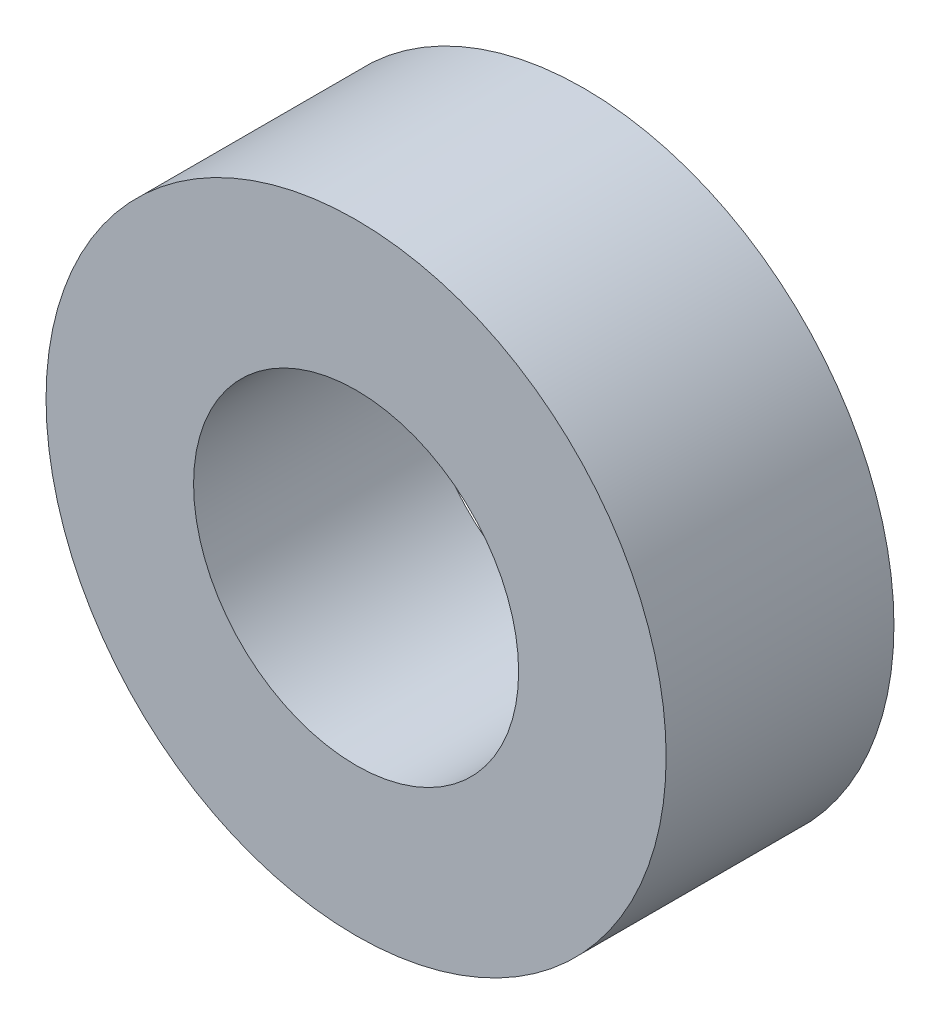
from build123d import *

# Parameters (mm, degrees)
SKETCH1_R           = 15.142307663
BOSS_EXTRUDE1_DEPTH = 11.1252
SKETCH2_R           = 7.9375
CUT_EXTRUDE1_DEPTH  = 11.1252


with BuildPart() as part:
    # Sketch1 → Boss-Extrude1 (new body)
    with BuildSketch(Plane.XY):
        with Locations(Location((0, 0, 0), (0, 0, 180))):
            Circle(SKETCH1_R)
    extrude(amount=BOSS_EXTRUDE1_DEPTH)

    # Sketch2 → Cut-Extrude1 (cut)
    with BuildSketch(Plane(origin=(0, 0, 0), x_dir=(-1, 0, 0), z_dir=(0, 0, -1))):
        Circle(SKETCH2_R)
    extrude(amount=-CUT_EXTRUDE1_DEPTH, mode=Mode.SUBTRACT)


solid = part.part
